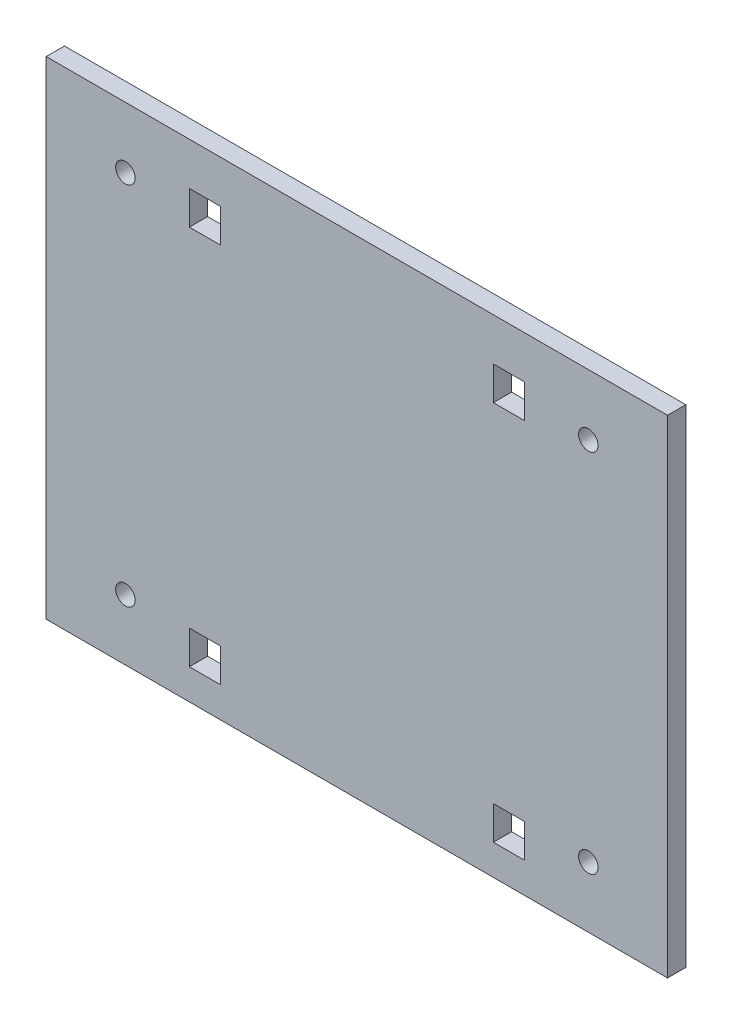
from build123d import *

# Parameters (mm, degrees)
SKETCH_1_W                       = 102
SKETCH_1_H                       = 80
SKETCH_1_R                       = 1.6
EXTRUDE_1_DEPTH                  = 3
SKETCH_4_W                       = 5.1
SKETCH_4_H                       = 5.5
CUT_EXTRUDE_2_DEPTH              = 5
PATTERN_LINEAR_1_COUNT           = 2
PATTERN_LINEAR_1_PITCH           = 62.5
PATTERN_LINEAR_1_COPY_1_SKETCH_W = 5.1
PATTERN_LINEAR_1_COPY_1_SKETCH_H = 5.5
PATTERN_LINEAR_1_COPY_1_DEPTH    = 5


with BuildPart() as part:
    # 草图1 → 凸台-拉伸1 (new body)
    with BuildSketch(Plane.XY):
        with Locations((0, -65.25)):
            Rectangle(SKETCH_1_W, SKETCH_1_H)
        with Locations((-38, -35.25)):
            Circle(SKETCH_1_R, mode=Mode.SUBTRACT)
        with Locations((-38, -95.25)):
            Circle(SKETCH_1_R, mode=Mode.SUBTRACT)
        with Locations((38, -95.25)):
            Circle(SKETCH_1_R, mode=Mode.SUBTRACT)
        with Locations((38, -35.25)):
            Circle(SKETCH_1_R, mode=Mode.SUBTRACT)
    extrude(amount=EXTRUDE_1_DEPTH)

    # 草图4 → 切除-拉伸2 (cut)
    with BuildSketch(Plane.XY.offset(3)):
        with Locations((-24.949999999, -97.5)):
            Rectangle(SKETCH_4_W, SKETCH_4_H)
    cut_extrude_2 = extrude(amount=-CUT_EXTRUDE_2_DEPTH, mode=Mode.SUBTRACT)

    # 镜向1: 切除-拉伸2 across plane
    add(cut_extrude_2.mirror(Plane.ZY), mode=Mode.SUBTRACT)

    # 阵列(线性)1: 切除-拉伸2 ×2
    with Locations(*[(0, i * PATTERN_LINEAR_1_PITCH, 0) for i in range(1, PATTERN_LINEAR_1_COUNT)]):
        add(cut_extrude_2, mode=Mode.SUBTRACT)

    # 阵列(线性)1 copy 1 sketch → 阵列(线性)1 copy 1 (cut)
    with BuildSketch(Plane(origin=(0, 62.5, 3), x_dir=(-1, 0, 0), z_dir=(0, 0, 1))):
        with Locations((-24.949999999, 97.5)):
            Rectangle(PATTERN_LINEAR_1_COPY_1_SKETCH_W, PATTERN_LINEAR_1_COPY_1_SKETCH_H)
    extrude(amount=-PATTERN_LINEAR_1_COPY_1_DEPTH, mode=Mode.SUBTRACT)


solid = part.part
